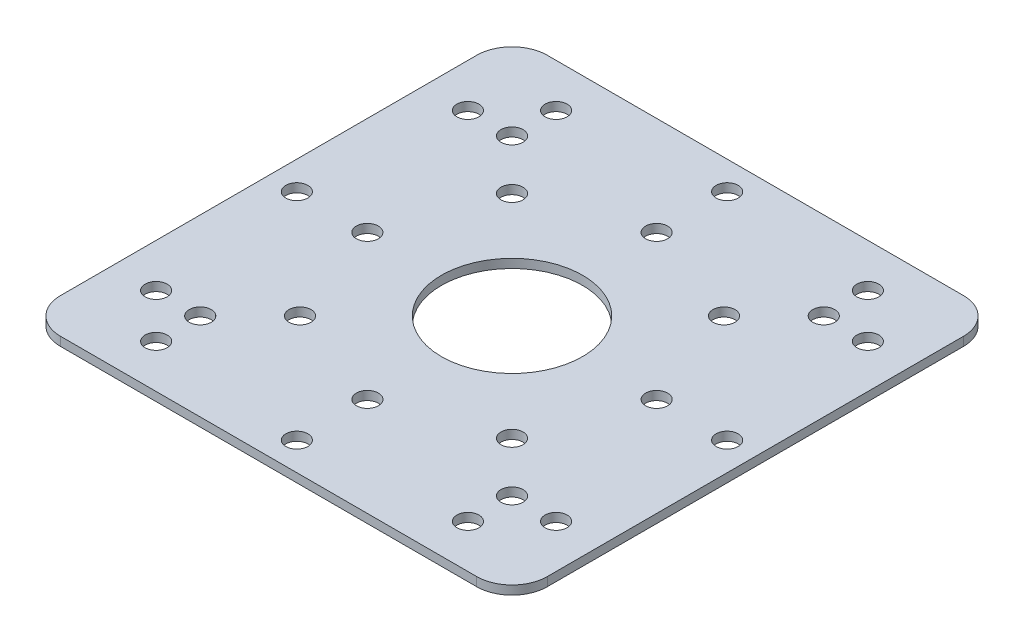
from build123d import *

# Parameters (mm, degrees)
BOSS_EXTRUDE1_DEPTH = 1.27
SKETCH2_R           = 10.16
SKETCH2_R_2         = 1.5875
CUT_EXTRUDE1_DEPTH  = 50.5872797


with BuildPart() as part:
    # Sketch1 → Boss-Extrude1 (new body)
    with BuildSketch(Plane(origin=(0, 0, 0), x_dir=(1, 0, 0), z_dir=(0, 1, 0))):
        with BuildLine():
            Line((29.972, -35.052), (-29.972, -35.052))
            ThreePointArc((-29.972, -35.052), (-33.564102448, -33.564102448), (-35.052, -29.972))
            Line((-35.052, -29.972), (-35.052, 29.972))
            ThreePointArc((-35.052, 29.972), (-33.564102448, 33.564102448), (-29.972, 35.052))
            Line((-29.972, 35.052), (29.972, 35.052))
            ThreePointArc((29.972, 35.052), (33.564102448, 33.564102448), (35.052, 29.972))
            Line((35.052, 29.972), (35.052, -29.972))
            ThreePointArc((35.052, -29.972), (33.564102448, -33.564102448), (29.972, -35.052))
        make_face()
    extrude(amount=BOSS_EXTRUDE1_DEPTH)

    # Sketch2 → Cut-Extrude1 (cut, through all)
    with BuildSketch(Plane(origin=(0, 1.27, 0), x_dir=(1, 0, 0), z_dir=(0, 1, 0))):
        with Locations(Location((0, 0, 0), (0, 0, 270))):
            Circle(SKETCH2_R)
        with Locations(Location((20.833792189, 0, 0), (0, 0, 270))):
            Circle(SKETCH2_R_2)
        with Locations(Location((30.988, 0, 0), (0, 0, 270))):
            Circle(SKETCH2_R_2)
        with Locations(Location((-20.833792189, 0, 0), (0, 0, 90))):
            Circle(SKETCH2_R_2)
        with Locations(Location((-30.988, 0, 0), (0, 0, 90))):
            Circle(SKETCH2_R_2)
        with Locations(Location((0, -20.828, 0), (0, 0, 270))):
            Circle(SKETCH2_R_2)
        with Locations(Location((0, 30.988, 0), (0, 0, 90))):
            Circle(SKETCH2_R_2)
        with Locations(Location((0, 20.828, 0), (0, 0, 90))):
            Circle(SKETCH2_R_2)
        with Locations(Location((-15.266435406, -15.266435406, 0), (0, 0, 270))):
            Circle(SKETCH2_R_2)
        with Locations(Location((-22.450640303, -22.450640303, 0), (0, 0, 270))):
            Circle(SKETCH2_R_2)
        with Locations(Location((-28.800640303, -22.450640303, 0), (0, 0, 270))):
            Circle(SKETCH2_R_2)
        with Locations(Location((-22.450640303, -28.800640303, 0), (0, 0, 270))):
            Circle(SKETCH2_R_2)
        with Locations(Location((28.800640303, -22.450640303, 0), (0, 0, 90))):
            Circle(SKETCH2_R_2)
        with Locations(Location((22.450640303, -28.800640303, 0), (0, 0, 90))):
            Circle(SKETCH2_R_2)
        with Locations(Location((22.450640303, -22.450640303, 0), (0, 0, 90))):
            Circle(SKETCH2_R_2)
        with Locations(Location((15.266435406, -15.266435406, 0), (0, 0, 90))):
            Circle(SKETCH2_R_2)
        with Locations(Location((28.800640303, 22.450640303, 0), (0, 0, 270))):
            Circle(SKETCH2_R_2)
        with Locations(Location((22.450640303, 28.800640303, 0), (0, 0, 270))):
            Circle(SKETCH2_R_2)
        with Locations(Location((22.450640303, 22.450640303, 0), (0, 0, 270))):
            Circle(SKETCH2_R_2)
        with Locations(Location((15.266435406, 15.266435406, 0), (0, 0, 270))):
            Circle(SKETCH2_R_2)
        with Locations(Location((-22.450640303, 28.800640303, 0), (0, 0, 90))):
            Circle(SKETCH2_R_2)
        with Locations(Location((-28.800640303, 22.450640303, 0), (0, 0, 90))):
            Circle(SKETCH2_R_2)
        with Locations(Location((-15.266435406, 15.266435406, 0), (0, 0, 90))):
            Circle(SKETCH2_R_2)
        with Locations(Location((-22.450640303, 22.450640303, 0), (0, 0, 90))):
            Circle(SKETCH2_R_2)
        with Locations(Location((0, -30.988, 0), (0, 0, 270))):
            Circle(SKETCH2_R_2)
    extrude(amount=-CUT_EXTRUDE1_DEPTH, mode=Mode.SUBTRACT)


solid = part.part
